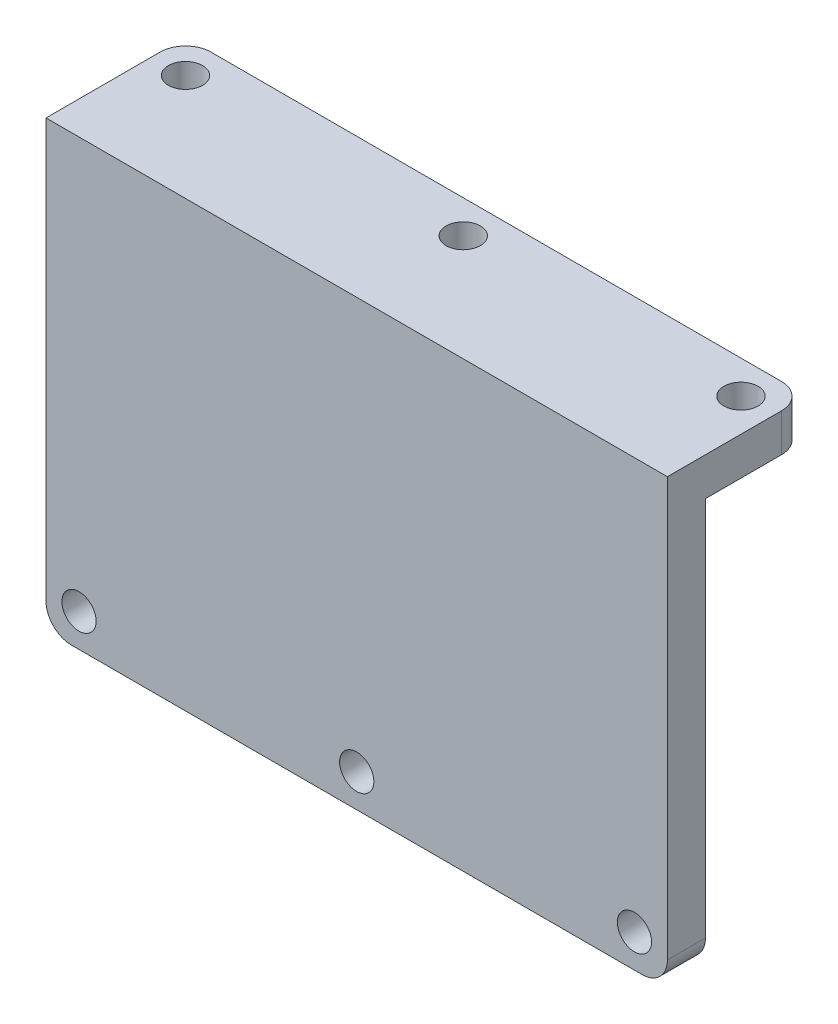
from build123d import *

# Parameters (mm, degrees)
ESBO_O1_W                = 49
ESBO_O1_H                = 35
RESSALTO_EXTRUS_O1_DEPTH = 3
ESBO_O2_R                = 1.35
CORTE_EXTRUS_O1_DEPTH    = 31.257230541
ESBO_O3_W                = 49
ESBO_O3_H                = 3
RESSALTO_EXTRUS_O3_DEPTH = 8
ESBO_O4_R                = 1.35
CORTE_EXTRUS_O2_DEPTH    = 44.465503563
FILETE1_R                = 2
FILETE2_R                = 2


with BuildPart() as part:
    # Esboço1 → Ressalto-extrusão1 (new body)
    with BuildSketch(Plane.XY):
        Rectangle(ESBO_O1_W, ESBO_O1_H)
    extrude(amount=RESSALTO_EXTRUS_O1_DEPTH)

    # Esboço2 → Corte-extrusão1 (cut, through all)
    with BuildSketch(Plane(origin=(0, 0, 0), x_dir=(-1, 0, 0), z_dir=(0, 0, -1))):
        with Locations((-21.9, -14.9)):
            Circle(ESBO_O2_R)
        with Locations((0, -14.9)):
            Circle(ESBO_O2_R)
        with Locations((21.9, -14.9)):
            Circle(ESBO_O2_R)
    extrude(amount=-CORTE_EXTRUS_O1_DEPTH, mode=Mode.SUBTRACT)

    # Esboço3 → Ressalto-extrusão3 (add)
    with BuildSketch(Plane(origin=(0, 0, 0), x_dir=(-1, 0, 0), z_dir=(0, 0, -1))):
        with Locations((0, 16)):
            Rectangle(ESBO_O3_W, ESBO_O3_H)
    extrude(amount=RESSALTO_EXTRUS_O3_DEPTH)

    # Esboço4 → Corte-extrusão2 (cut, through all)
    with BuildSketch(Plane(origin=(0, 17.5, 0), x_dir=(1, 0, 0), z_dir=(0, 1, 0))):
        with Locations(Location((-21.9, 5.4, 0), (0, 0, 270))):
            Circle(ESBO_O4_R)
        with Locations(Location((0, 5.4, 0), (0, 0, 270))):
            Circle(ESBO_O4_R)
        with Locations(Location((21.9, 5.4, 0), (0, 0, 270))):
            Circle(ESBO_O4_R)
    extrude(amount=-CORTE_EXTRUS_O2_DEPTH, mode=Mode.SUBTRACT)

    # Filete1
    filete1_edges = [part.edges().sort_by_distance(p)[0] for p in [
        (24.5, -17.5, 1.5),
        (-24.5, -17.5, 1.5),
    ]]
    fillet(filete1_edges, radius=FILETE1_R)

    # Filete2
    filete2_edges = [part.edges().sort_by_distance(p)[0] for p in [
        (24.5, 16, -8),
        (-24.5, 16, -8),
    ]]
    fillet(filete2_edges, radius=FILETE2_R)


solid = part.part
